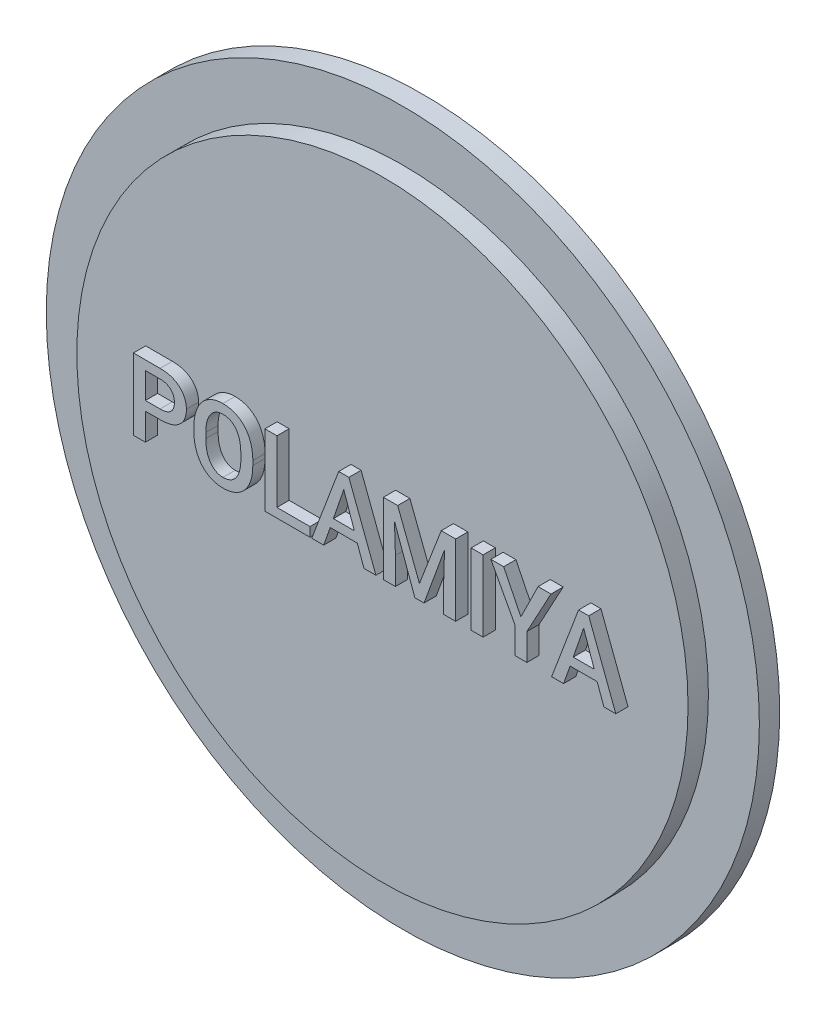
from build123d import *

# Parameters (mm, degrees)
SKETCH_1_R      = 17.5
EXTRUDE_1_DEPTH = 1
SKETCH_2_R      = 15
EXTRUDE_2_DEPTH = 1
SKETCH_3_W      = 0.588068182
SKETCH_3_H      = 3.5
EXTRUDE_3_DEPTH = 0.6


with BuildPart() as part:
    # 草图1 → 凸台-拉伸1 (new body)
    with BuildSketch(Plane.XY):
        Circle(SKETCH_1_R)
    extrude(amount=EXTRUDE_1_DEPTH)

    # 草图2 → 凸台-拉伸2 (add)
    with BuildSketch(Plane.XY.offset(1)):
        Circle(SKETCH_2_R)
    extrude(amount=EXTRUDE_2_DEPTH)

    # 草图3 → 凸台-拉伸3 (add)
    # profile 1 of 8: a face of its own
    with BuildSketch(Plane.XY.offset(2)):
        with BuildLine():
            Line((-11.034090909, -0.181818182), (-11.034090909, -1.5))
            Line((-11.034090909, -1.5), (-11.622159091, -1.5))
            Line((-11.622159091, -1.5), (-11.622159091, 2))
            Line((-11.622159091, 2), (-10.313210227, 2))
            add(Edge.make_bspline(
                [(-10.313210227, 2), (-10.263937504, 1.999013402), (-10.167784487, 1.99708811), (-10.027836881, 1.983084871), (-9.896369019, 1.958654109), (-9.772780978, 1.926086737), (-9.658194941, 1.881175791), (-9.550898361, 1.829317055), (-9.452701975, 1.766016566), (-9.363704955, 1.693563062), (-9.283221905, 1.614533339), (-9.214179907, 1.528478792), (-9.154558896, 1.437947401), (-9.105778167, 1.341570199), (-9.069254128, 1.239242212), (-9.04178542, 1.132358412), (-9.026222089, 1.019868131), (-9.02390808, 0.943227819), (-9.022727273, 0.904119318)],
                knots=[0, 0, 0, 0, 1.240574792, 2.420913645, 3.536292172, 4.604912037, 5.633323155, 6.630349489, 7.600956123, 8.567288432, 9.515675513, 10.435456435, 11.339829486, 12.240876431, 13.147897667, 14.070282539, 15.015291628, 16, 16, 16, 16], degree=3))
            add(Edge.make_bspline(
                [(-9.022727273, 0.904119318), (-9.023579813, 0.863109875), (-9.025247114, 0.782908265), (-9.041276862, 0.665857031), (-9.067202798, 0.555299916), (-9.104390412, 0.451766254), (-9.15153283, 0.354914634), (-9.20925185, 0.264860523), (-9.278228613, 0.182178801), (-9.356487621, 0.105907547), (-9.444510622, 0.037361242), (-9.543163933, -0.020614082), (-9.649542168, -0.071536834), (-9.765986541, -0.111638671), (-9.890834369, -0.143880562), (-10.025500124, -0.164876223), (-10.168690406, -0.180011238), (-10.267475273, -0.181205278), (-10.318181818, -0.181818182)],
                knots=[0, 0, 0, 0, 1.026197981, 2.006921409, 2.951407107, 3.864404519, 4.755042915, 5.642836949, 6.535268148, 7.444796126, 8.374247671, 9.320572644, 10.304175273, 11.322038217, 12.398734908, 13.528044583, 14.731138463, 16, 16, 16, 16], degree=3))
            Line((-10.318181818, -0.181818182), (-11.034090909, -0.181818182))
        make_face()
        with BuildLine():
            Line((-11.034090909, 0.272727273), (-10.313210227, 0.272727273))
            add(Edge.make_bspline(
                [(-10.313210227, 0.272727273), (-10.285262474, 0.273371614), (-10.231169313, 0.274618743), (-10.152524561, 0.281393818), (-10.079138194, 0.294191147), (-10.010861978, 0.312133055), (-9.947153396, 0.33352948), (-9.889287765, 0.361718098), (-9.836376654, 0.394185195), (-9.789108636, 0.432325717), (-9.747020094, 0.474894791), (-9.710774964, 0.522382364), (-9.67858339, 0.573716692), (-9.654714479, 0.630928745), (-9.633907354, 0.691671507), (-9.621298128, 0.757414616), (-9.612197752, 0.827396873), (-9.611272488, 0.875676788), (-9.610795455, 0.900568182)],
                knots=[0, 0, 0, 0, 1.247160661, 2.413892185, 3.518379394, 4.566257178, 5.561768952, 6.511390236, 7.431774355, 8.325901159, 9.214771292, 10.09582426, 10.987138846, 11.909521104, 12.854843972, 13.84715627, 14.890070941, 16, 16, 16, 16], degree=3))
            add(Edge.make_bspline(
                [(-9.610795455, 0.900568182), (-9.611333742, 0.924029287), (-9.612392247, 0.97016397), (-9.620906934, 1.037496272), (-9.635368233, 1.101087911), (-9.654174529, 1.161376079), (-9.680047701, 1.217712797), (-9.711547744, 1.27032486), (-9.747823748, 1.320125823), (-9.790660804, 1.364939582), (-9.837279523, 1.406781133), (-9.889577877, 1.441902832), (-9.945329677, 1.472769275), (-10.005386973, 1.498689796), (-10.070103637, 1.518020082), (-10.138873075, 1.533326721), (-10.211899997, 1.542282685), (-10.262051699, 1.544382895), (-10.287642045, 1.545454545)],
                knots=[0, 0, 0, 0, 1.068982798, 2.102082669, 3.086250311, 4.03819262, 4.974849611, 5.90370697, 6.829426077, 7.775911327, 8.723871238, 9.678499895, 10.639448252, 11.625447454, 12.652671614, 13.712907346, 14.832990875, 16, 16, 16, 16], degree=3))
            Line((-10.287642045, 1.545454545), (-11.034090909, 1.545454545))
            Line((-11.034090909, 1.545454545), (-11.034090909, 0.272727273))
        make_face(mode=Mode.SUBTRACT)
    # profile 2 of 8: a face of its own
    with BuildSketch(Plane.XY.offset(2)):
        with BuildLine():
            add(Edge.make_bspline(
                [(-5.762784091, 0.139914773), (-5.763371585, 0.098709571), (-5.764527378, 0.01764538), (-5.772426922, -0.102298489), (-5.785687342, -0.218487926), (-5.805015805, -0.330799417), (-5.829152109, -0.439434142), (-5.858691583, -0.544374152), (-5.894640095, -0.645408252), (-5.934513254, -0.742823584), (-5.981140195, -0.834925617), (-6.031262002, -0.922996808), (-6.087581007, -1.004993813), (-6.147884242, -1.082474657), (-6.214402106, -1.153516753), (-6.285547789, -1.219489919), (-6.360957643, -1.281200595), (-6.441866978, -1.33633393), (-6.527182427, -1.385330126), (-6.616207364, -1.428057836), (-6.709002114, -1.464430635), (-6.805563333, -1.494348109), (-6.906083812, -1.516878774), (-7.009995035, -1.533140253), (-7.117694906, -1.543356348), (-7.190791566, -1.54474699), (-7.227982955, -1.545454545)],
                knots=[0, 0, 0, 0, 1.176848037, 2.3152474, 3.431584712, 4.515421335, 5.568599415, 6.608848144, 7.626794036, 8.630127615, 9.612904135, 10.573209516, 11.522188197, 12.451498809, 13.374886727, 14.298274645, 15.221241598, 16.15523885, 17.091216544, 18.028756073, 18.973001422, 19.935446895, 20.913092606, 21.912476711, 22.937873625, 24, 24, 24, 24], degree=3))
            add(Edge.make_bspline(
                [(-7.227982955, -1.545454545), (-7.262325103, -1.544641568), (-7.330419456, -1.543029578), (-7.4311422, -1.534154926), (-7.528513866, -1.517346967), (-7.623199658, -1.495713269), (-7.714516266, -1.46606742), (-7.803778693, -1.431879995), (-7.88895851, -1.38922816), (-7.971704485, -1.341977075), (-8.050065306, -1.28798779), (-8.124476843, -1.229038912), (-8.193530921, -1.163681741), (-8.258841413, -1.093709596), (-8.319321717, -1.018175124), (-8.374958507, -0.93739934), (-8.426135509, -0.851233915), (-8.472763139, -0.759862783), (-8.514679173, -0.664111715), (-8.550927199, -0.564469568), (-8.581472244, -0.460986633), (-8.606698516, -0.354002337), (-8.62794957, -0.243463329), (-8.641380379, -0.129264166), (-8.651052809, -0.011519211), (-8.653085887, 0.068162063), (-8.654119318, 0.108664773)],
                knots=[0, 0, 0, 0, 1.008285983, 1.999251197, 2.964665726, 3.906966389, 4.847651172, 5.780706426, 6.710001385, 7.640957932, 8.575848919, 9.500559112, 10.424877507, 11.364097908, 12.308344206, 13.262562884, 14.241070651, 15.248086495, 16.271963004, 17.307448327, 18.358511302, 19.437306907, 20.533180959, 21.660661025, 22.810892918, 24, 24, 24, 24], degree=3))
            Line((-8.654119318, 0.108664773), (-8.654119318, 0.355113636))
            add(Edge.make_bspline(
                [(-8.654119318, 0.355113636), (-8.653606956, 0.396323824), (-8.652595834, 0.477650175), (-8.643580201, 0.597773593), (-8.630470289, 0.714450892), (-8.611239755, 0.827545582), (-8.586460959, 0.937121774), (-8.555868755, 1.042807926), (-8.520252414, 1.145075121), (-8.479292608, 1.243292887), (-8.433325234, 1.337159057), (-8.381873752, 1.425547813), (-8.326157658, 1.508592543), (-8.265104045, 1.585507543), (-8.200915655, 1.658014205), (-8.129850534, 1.722978662), (-8.055460076, 1.783689776), (-7.976300421, 1.838376077), (-7.893668816, 1.887467648), (-7.807096961, 1.929114428), (-7.718449895, 1.965845671), (-7.62637973, 1.99477279), (-7.531916709, 2.01743418), (-7.434683532, 2.034107038), (-7.334449597, 2.043065588), (-7.266587974, 2.044651793), (-7.232244318, 2.045454545)],
                knots=[0, 0, 0, 0, 1.194278616, 2.356852218, 3.489723869, 4.596377868, 5.680051767, 6.74419288, 7.783690657, 8.817192067, 9.826818244, 10.810723402, 11.779436855, 12.72251171, 13.655371051, 14.5827378, 15.509723675, 16.436709549, 17.368760958, 18.292490312, 19.218866461, 20.147679111, 21.086350089, 22.032813904, 23.004439328, 24, 24, 24, 24], degree=3))
            add(Edge.make_bspline(
                [(-7.232244318, 2.045454545), (-7.195526285, 2.044735954), (-7.122903041, 2.043314677), (-7.015917703, 2.03314185), (-6.912146338, 2.017025526), (-6.812047543, 1.993452091), (-6.715217719, 1.963597399), (-6.621721216, 1.927485201), (-6.532177269, 1.88384058), (-6.446065958, 1.834275831), (-6.364659332, 1.778093798), (-6.287778374, 1.716874148), (-6.215573543, 1.650900677), (-6.149430492, 1.578413266), (-6.087646451, 1.501302148), (-6.031122236, 1.418565257), (-5.981153822, 1.329938422), (-5.934492251, 1.237137832), (-5.89478765, 1.13919325), (-5.858670747, 1.037990162), (-5.82915937, 0.933039714), (-5.805007844, 0.824408706), (-5.785752608, 0.712324755), (-5.772376887, 0.596385877), (-5.76455293, 0.476908054), (-5.763379075, 0.396081612), (-5.762784091, 0.355113636)],
                knots=[0, 0, 0, 0, 1.046249985, 2.069339225, 3.059810452, 4.036771256, 4.997050728, 5.945454717, 6.889891125, 7.832977167, 8.774251647, 9.705658379, 10.631919855, 11.558181331, 12.499068893, 13.445911881, 14.4099049, 15.396508522, 16.403816289, 17.419471276, 18.457378907, 19.508186792, 20.589584221, 21.696707803, 22.832545178, 24, 24, 24, 24], degree=3))
            Line((-5.762784091, 0.355113636), (-5.762784091, 0.139914773))
        make_face()
        with BuildLine():
            add(Edge.make_bspline(
                [(-6.348721591, 0.363636364), (-6.349270286, 0.411960153), (-6.350337033, 0.505909101), (-6.362391391, 0.642424584), (-6.379346299, 0.77044167), (-6.404676267, 0.889537112), (-6.438484777, 0.999243983), (-6.477580354, 1.100801053), (-6.525610454, 1.192962984), (-6.580261787, 1.276317084), (-6.641334942, 1.350808344), (-6.709166619, 1.41481149), (-6.782095696, 1.469608991), (-6.86124845, 1.513907806), (-6.945766107, 1.549017136), (-7.036606559, 1.572822621), (-7.13252152, 1.588245915), (-7.198565231, 1.590009664), (-7.232244318, 1.590909091)],
                knots=[0, 0, 0, 0, 1.357211552, 2.638629952, 3.847301741, 4.98353323, 6.054426908, 7.069658053, 8.036458229, 8.968025747, 9.865590507, 10.735957198, 11.581968629, 12.421787473, 13.277727551, 14.145727694, 15.054411112, 16, 16, 16, 16], degree=3))
            add(Edge.make_bspline(
                [(-7.232244318, 1.590909091), (-7.262364371, 1.589925187), (-7.321526767, 1.587992585), (-7.408166171, 1.573598658), (-7.490142455, 1.549344538), (-7.568185003, 1.515696005), (-7.641009901, 1.47132301), (-7.710121443, 1.418024962), (-7.774968596, 1.35537313), (-7.834240588, 1.282614198), (-7.888845256, 1.201476754), (-7.935010857, 1.110707163), (-7.976297146, 1.012265533), (-8.008007814, 0.904619275), (-8.034629338, 0.789183219), (-8.053440555, 0.665016747), (-8.065609544, 0.532432588), (-8.067778482, 0.441078551), (-8.068892045, 0.394176136)],
                knots=[0, 0, 0, 0, 0.883612322, 1.735608613, 2.568702391, 3.386949617, 4.222126278, 5.064180015, 5.943604124, 6.861559285, 7.813378835, 8.80767859, 9.844928978, 10.941526409, 12.095925948, 13.319175924, 14.62362817, 16, 16, 16, 16], degree=3))
            Line((-8.068892045, 0.394176136), (-8.068181818, 0.140625))
            add(Edge.make_bspline(
                [(-8.068181818, 0.140625), (-8.067517157, 0.092547679), (-8.066222126, -0.001126519), (-8.055721114, -0.137317073), (-8.037451007, -0.264746664), (-8.011614799, -0.383293456), (-7.980226289, -0.493804194), (-7.940681317, -0.595812768), (-7.892626941, -0.688456821), (-7.838913257, -0.772822374), (-7.778422694, -0.847187063), (-7.71362465, -0.912688052), (-7.64362775, -0.967647794), (-7.569275587, -1.012829062), (-7.490331161, -1.048104593), (-7.40674238, -1.072784341), (-7.318749848, -1.088196533), (-7.258586813, -1.089994498), (-7.227982955, -1.090909091)],
                knots=[0, 0, 0, 0, 1.37991145, 2.688629364, 3.917794467, 5.072075201, 6.168874966, 7.21249264, 8.206337796, 9.160136215, 10.078162084, 10.952702481, 11.799639578, 12.625932723, 13.444251396, 14.274141439, 15.12208665, 16, 16, 16, 16], degree=3))
            add(Edge.make_bspline(
                [(-7.227982955, -1.090909091), (-7.194314871, -1.08995095), (-7.128796726, -1.088086405), (-7.033220082, -1.073654306), (-6.943634317, -1.049594107), (-6.859462428, -1.016140403), (-6.781704127, -0.972267661), (-6.709164749, -0.919648708), (-6.643737679, -0.856018367), (-6.583022081, -0.784273053), (-6.529153667, -0.702918471), (-6.481957449, -0.612749357), (-6.442705446, -0.513500296), (-6.40894953, -0.40612077), (-6.384014337, -0.28974245), (-6.365058513, -0.165230926), (-6.351720488, -0.03200045), (-6.349742059, 0.059861954), (-6.348721591, 0.107244318)],
                knots=[0, 0, 0, 0, 0.963091816, 1.874178257, 2.758245153, 3.612374316, 4.458514735, 5.306686446, 6.16910287, 7.06333683, 7.991464194, 8.955008551, 9.970153771, 11.041448949, 12.172238607, 13.371734544, 14.644348239, 16, 16, 16, 16], degree=3))
            Line((-6.348721591, 0.107244318), (-6.348721591, 0.363636364))
        make_face(mode=Mode.SUBTRACT)
    # profile 3 of 8: a face of its own
    with BuildSketch(Plane.XY.offset(2)):
        Polygon((-4.580255682, -1.045454545), (-2.956676136, -1.045454545), (-2.956676136, -1.5), (-5.170454545, -1.5), (-5.170454545, 2), (-4.580255682, 2), align=None)
    # profile 4 of 8: a face of its own
    with BuildSketch(Plane.XY.offset(2)):
        Polygon((-0.633522727, -0.590909091), (-1.961647727, -0.590909091), (-2.283380682, -1.5), (-2.869318182, -1.5), (-1.546875, 2), (-1.048295455, 2), (0.280539773, -1.5), (-0.306107955, -1.5), align=None)
        Polygon((-1.808238636, -0.136363636), (-0.780539773, -0.136363636), (-1.296875, 1.354403409), align=None, mode=Mode.SUBTRACT)
    # profile 5 of 8: a face of its own
    with BuildSketch(Plane.XY.offset(2)):
        Polygon((1.348011364, 2), (2.416903409, -0.78125), (3.485795455, 2), (4.193181818, 2), (4.193181818, -1.5), (3.605113636, -1.5), (3.605113636, -0.126420455), (3.647017045, 1.260653409), (2.640625, -1.5), (2.191051136, -1.5), (1.191051136, 1.253551136), (1.235795455, -0.171875), (1.235795455, -1.5), (0.647727273, -1.5), (0.647727273, 2), align=None)
    # profile 6 of 8: a face of its own
    with BuildSketch(Plane.XY.offset(2)):
        with Locations((5.247159091, 0.25)):
            Rectangle(SKETCH_3_W, SKETCH_3_H)
    # profile 7 of 8: a face of its own
    with BuildSketch(Plane.XY.offset(2)):
        Polygon((7.394176136, 0.288352273), (8.240056818, 2), (8.871448864, 2), (7.691051136, -0.184659091), (7.691051136, -1.5), (7.102982955, -1.5), (7.102982955, -0.196022727), (5.921875, 2), (6.551136364, 2), align=None)
    # profile 8 of 8: a face of its own
    with BuildSketch(Plane.XY.offset(2)):
        Polygon((11.139204545, -0.590909091), (9.811079545, -0.590909091), (9.489346591, -1.5), (8.903409091, -1.5), (10.225852273, 2), (10.724431818, 2), (12.053267045, -1.5), (11.466619318, -1.5), align=None)
        Polygon((9.964488636, -0.136363636), (10.9921875, -0.136363636), (10.475852273, 1.354403409), align=None, mode=Mode.SUBTRACT)
    extrude(amount=EXTRUDE_3_DEPTH)


solid = part.part
